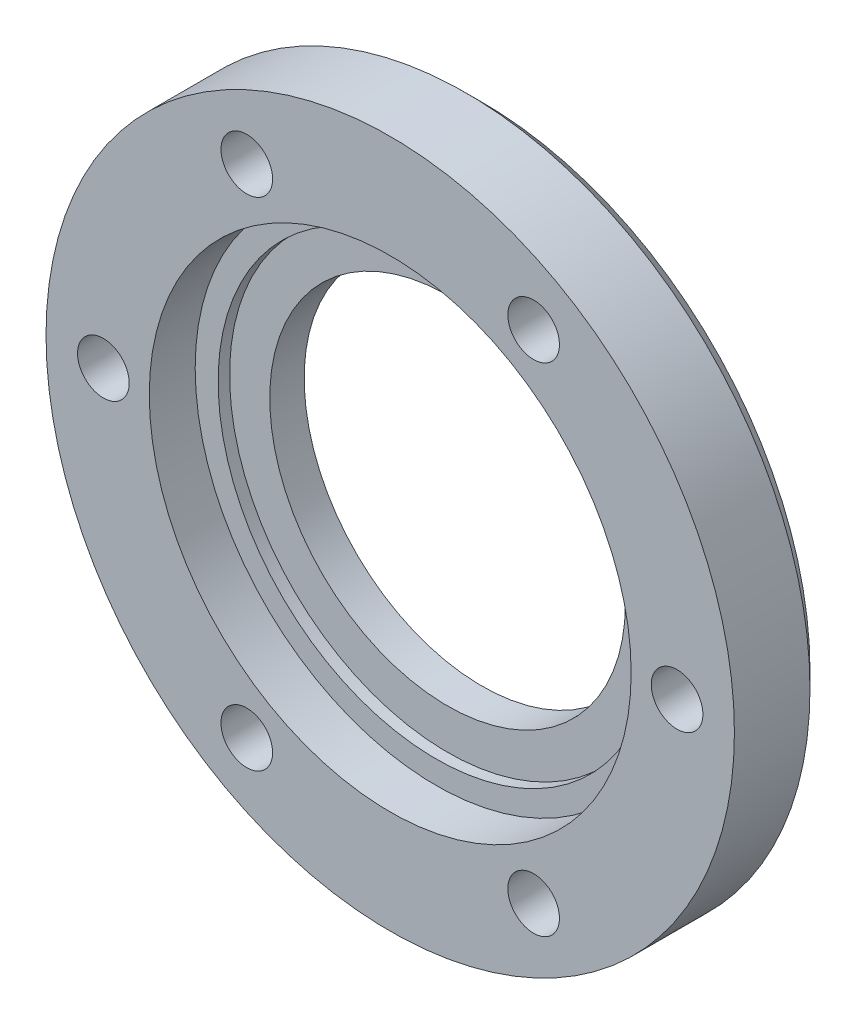
from build123d import *

# Parameters (mm, degrees)
SKETCH_1_R          = 30
SKETCH_1_R_2        = 15.5
EXTRUDE_1_DEPTH     = 8
SKETCH_2_R          = 21
CUT_EXTRUDE_1_DEPTH = 4
SKETCH_3_R          = 19
CUT_EXTRUDE_2_DEPTH = 1
SKETCH_4_R          = 2.25
CUT_EXTRUDE_3_DEPTH = 44.17406629
SKETCH_5_R          = 3.5
CUT_EXTRUDE_4_DEPTH = 4
CHAMFER_1_SIZE      = 1.414


with BuildPart() as part:
    # 草图1 → 拉伸1 (new body)
    with BuildSketch(Plane.XY):
        Circle(SKETCH_1_R)
        Circle(SKETCH_1_R_2, mode=Mode.SUBTRACT)
    extrude(amount=EXTRUDE_1_DEPTH)

    # 草图2 → 切除-拉伸1 (cut)
    with BuildSketch(Plane.XY.offset(8)):
        Circle(SKETCH_2_R)
    extrude(amount=-CUT_EXTRUDE_1_DEPTH, mode=Mode.SUBTRACT)

    # 草图3 → 切除-拉伸2 (cut)
    with BuildSketch(Plane.XY.offset(4)):
        Circle(SKETCH_3_R)
    extrude(amount=-CUT_EXTRUDE_2_DEPTH, mode=Mode.SUBTRACT)

    # 草图4 → 切除-拉伸3 (cut, through all)
    with BuildSketch(Plane(origin=(0, 0, 0), x_dir=(-1, 0, 0), z_dir=(0, 0, -1))):
        with Locations((12.5, 21.650635095)):
            Circle(SKETCH_4_R)
        with Locations((-12.5, 21.650635095)):
            Circle(SKETCH_4_R)
        with Locations((-25, 0)):
            Circle(SKETCH_4_R)
        with Locations((-12.5, -21.650635095)):
            Circle(SKETCH_4_R)
        with Locations((12.5, -21.650635095)):
            Circle(SKETCH_4_R)
        with Locations((25, 0)):
            Circle(SKETCH_4_R)
    extrude(amount=-CUT_EXTRUDE_3_DEPTH, mode=Mode.SUBTRACT)

    # 草图5 → 切除-拉伸4 (cut)
    with BuildSketch(Plane(origin=(0, 0, 0), x_dir=(-1, 0, 0), z_dir=(0, 0, -1))):
        with Locations((-12.5, 21.650635095)):
            Circle(SKETCH_5_R)
        with Locations((-25, 0)):
            Circle(SKETCH_5_R)
        with Locations((-12.5, -21.650635095)):
            Circle(SKETCH_5_R)
        with Locations((12.5, -21.650635095)):
            Circle(SKETCH_5_R)
        with Locations((25, 0)):
            Circle(SKETCH_5_R)
        with Locations((12.5, 21.650635095)):
            Circle(SKETCH_5_R)
    extrude(amount=-CUT_EXTRUDE_4_DEPTH, mode=Mode.SUBTRACT)

    # 倒角1
    chamfer_1_edges = [part.edges().sort_by_distance(p)[0] for p in [
        (-30, 0, 0),
    ]]
    chamfer(chamfer_1_edges, length=CHAMFER_1_SIZE)


solid = part.part
